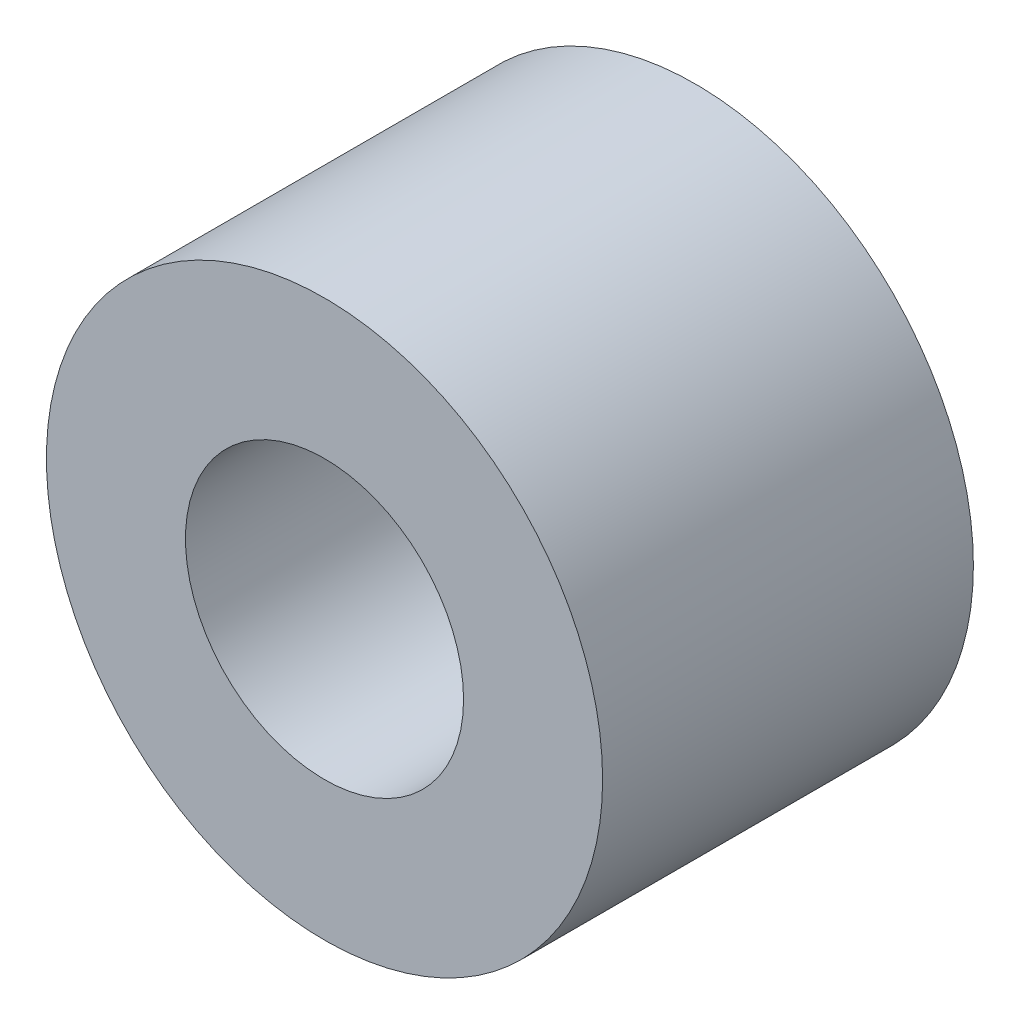
from build123d import *

# Parameters (mm, degrees)
SKETCH1_R           = 3
SKETCH1_R_2         = 1.5
BOSS_EXTRUDE1_DEPTH = 4


with BuildPart() as part:
    # Sketch1 → Boss-Extrude1 (new body)
    with BuildSketch(Plane.XY):
        with Locations((-12.5, -45.663872362)):
            Circle(SKETCH1_R)
        with Locations((-12.5, -45.663872362)):
            Circle(SKETCH1_R_2, mode=Mode.SUBTRACT)
    extrude(amount=-BOSS_EXTRUDE1_DEPTH)


solid = part.part
